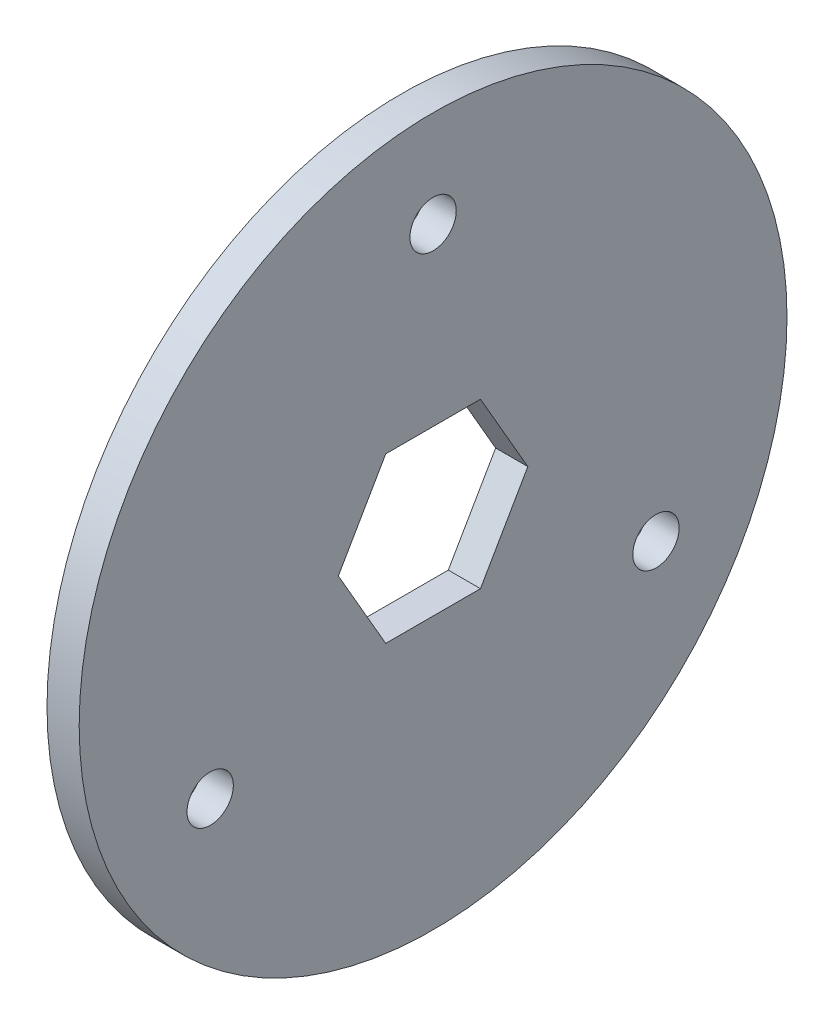
from build123d import *

# Parameters (mm, degrees)
SKETCH1_R           = 27.5
SKETCH1_R_2         = 1.8
BOSS_EXTRUDE1_DEPTH = 2.5


with BuildPart() as part:
    # Sketch1 → Boss-Extrude1 (new body)
    with BuildSketch(Plane(origin=(0, 0, 0), x_dir=(0, 0, -1), z_dir=(1, 0, 0))):
        Circle(SKETCH1_R)
        with Locations((0, 20)):
            Circle(SKETCH1_R_2, mode=Mode.SUBTRACT)
        with Locations((-17.320508076, -10)):
            Circle(SKETCH1_R_2, mode=Mode.SUBTRACT)
        with Locations((17.320508076, -10)):
            Circle(SKETCH1_R_2, mode=Mode.SUBTRACT)
        Polygon((3.680607966, 6.375), (-3.680607966, 6.375), (-7.361215932, 0), (-3.680607966, -6.375), (3.680607966, -6.375), (7.361215932, 0), align=None, mode=Mode.SUBTRACT)
    extrude(amount=BOSS_EXTRUDE1_DEPTH)


solid = part.part
